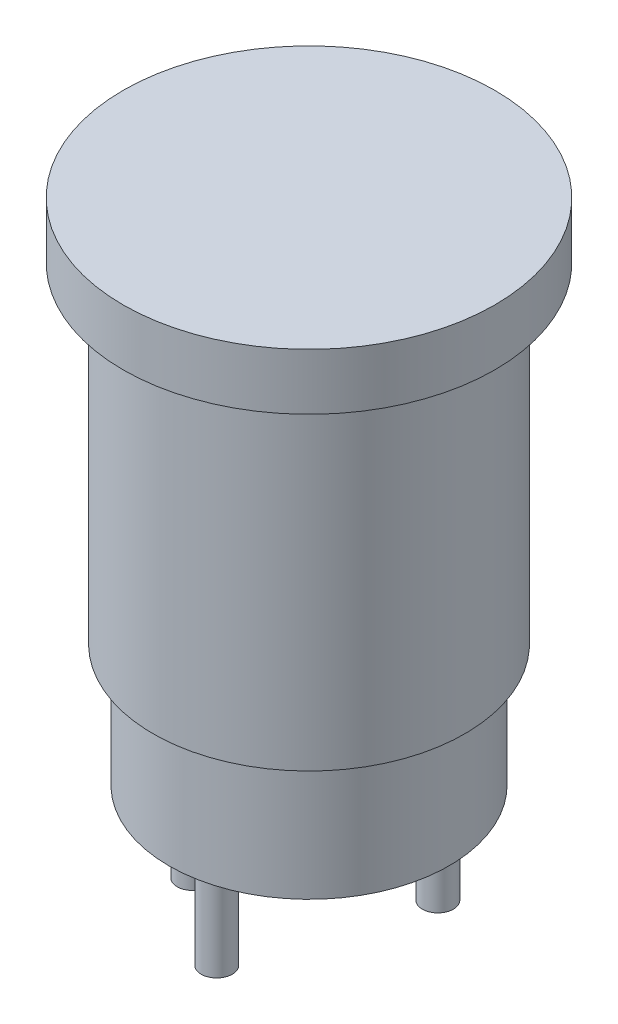
from build123d import *

# Parameters (mm, degrees)
SKETCH2_R           = 0.635
BOSS_EXTRUDE1_DEPTH = 4.5
CIRPATTERN1_COUNT   = 4
CIRPATTERN1_ANGLE   = 216


with BuildPart() as part:
    # Sketch1 → Revolve1 (revolve)
    with BuildSketch(Plane.XY, mode=Mode.PRIVATE) as revolve1_sk:
        Polygon((0, 0), (7.6, 0), (7.6, -2.3), (6.375, -2.3), (6.375, -15.8), (5.728350463, -15.8), (5.728350463, -20.8), (0, -20.8), align=None)
    revolve(revolve1_sk.sketch.rotate(Axis((0, -20.8, 0), (0, 1, 0)), 90), axis=Axis((0, -20.8, 0), (0, 1, 0)))

    # Sketch2 → Boss-Extrude1 (add)
    with BuildSketch(Plane.XZ.offset(20.8)):
        with Locations(Location((0, 3.773128742, 0), (0, 0, 270))):
            Circle(SKETCH2_R)
    boss_extrude1 = extrude(amount=BOSS_EXTRUDE1_DEPTH)

    # CirPattern1: Boss-Extrude1 ×4 about axis
    cirpattern1_axis = Axis((0, 0, 0), (0, -1, 0))
    for i in range(1, CIRPATTERN1_COUNT):
        add(boss_extrude1.rotate(cirpattern1_axis, i * CIRPATTERN1_ANGLE / (CIRPATTERN1_COUNT - 1)))


solid = part.part
